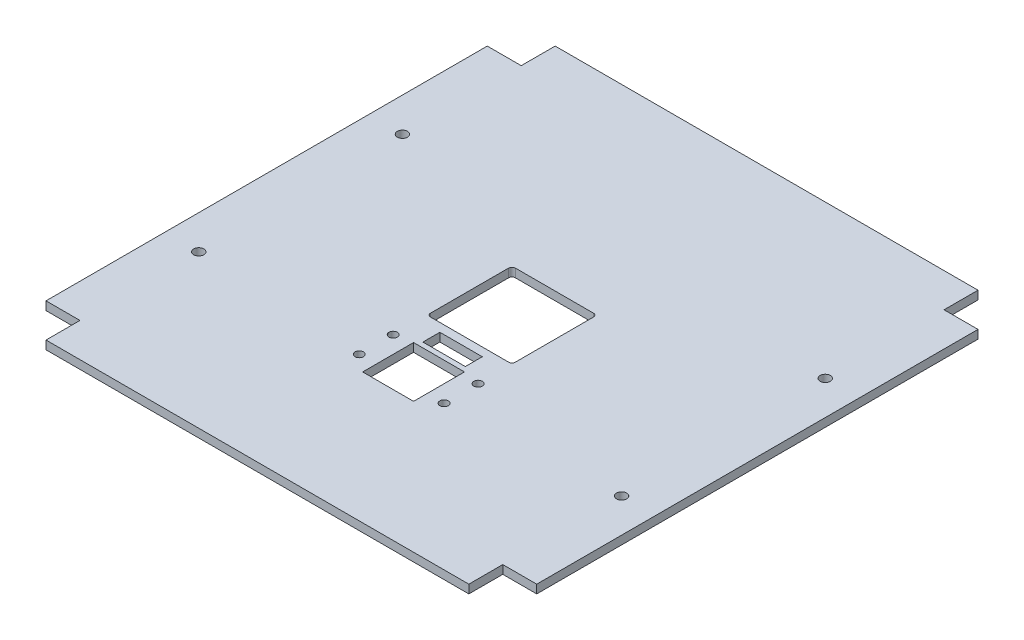
from build123d import *

# Parameters (mm, degrees)
ESQUISSE1_W             = 40
ESQUISSE1_H             = 80
ESQUISSE1_R             = 3
BOSS_EXTRU_1_DEPTH      = 5
ESQUISSE2_R             = 2.5
ESQUISSE2_W             = 30
ESQUISSE2_H             = 30
ESQUISSE2_W_2           = 25
ESQUISSE2_H_2           = 10
ENL_V_MAT_EXTRU_1_DEPTH = 209.386659842
ESQUISSE4_W             = 20
ESQUISSE4_H             = 20
ENL_V_MAT_EXTRU_2_DEPTH = 10


with BuildPart() as part:
    # Esquisse1 → Boss.-Extru.1 (new body)
    # profile 1 of 7: a face of its own
    with BuildSketch(Plane(origin=(0, 0, 0), x_dir=(1, 0, 0), z_dir=(0, 1, 0))):
        with BuildLine():
            ThreePointArc((4.38e-07, -150), (-90.829510449, -119.373363996), (-144.568322948, -40))
            Line((-144.568322948, -40), (-144.568322948, -150))
            Line((-144.568322948, -150), (4.38e-07, -150))
        make_face()
    # profile 2 of 7: a face of its own
    with BuildSketch(Plane(origin=(0, 0, 0), x_dir=(1, 0, 0), z_dir=(0, 1, 0))):
        with BuildLine():
            ThreePointArc((144.568322948, -40), (90.829510797, -119.373363731), (4.38e-07, -150))
            Line((4.38e-07, -150), (144.568322948, -150))
            Line((144.568322948, -150), (144.568322948, -40))
        make_face()
    # profile 3 of 7: a face of its own
    with BuildSketch(Plane(origin=(0, 0, 0), x_dir=(1, 0, 0), z_dir=(0, 1, 0))):
        with Locations((124.568322948, 0)):
            Rectangle(ESQUISSE1_W, ESQUISSE1_H)
    # profile 4 of 7: a face of its own
    with BuildSketch(Plane(origin=(0, 0, 0), x_dir=(1, 0, 0), z_dir=(0, 1, 0))):
        with BuildLine():
            ThreePointArc((2.28e-07, 150), (-90.829510532, 119.373363932), (-144.568322948, 40))
            Line((-144.568322948, 40), (-104.568322948, 40))
            Line((-104.568322948, 40), (-104.568322948, -40))
            Line((-104.568322948, -40), (-144.568322948, -40))
            ThreePointArc((-144.568322948, -40), (-90.829510449, -119.373363996), (4.38e-07, -150))
            ThreePointArc((4.38e-07, -150), (90.829510797, -119.373363731), (144.568322948, -40))
            Line((144.568322948, -40), (104.568322948, -40))
            Line((104.568322948, -40), (104.568322948, 40))
            Line((104.568322948, 40), (144.568322948, 40))
            ThreePointArc((144.568322948, 40), (90.829510714, 119.373363794), (2.28e-07, 150))
        make_face()
        with Locations(Location((-124.568322948, -60, 0), (0, 0, 270))):
            Circle(ESQUISSE1_R, mode=Mode.SUBTRACT)
        with Locations(Location((124.568322948, -60, 0), (0, 0, 270))):
            Circle(ESQUISSE1_R, mode=Mode.SUBTRACT)
        with Locations(Location((-124.568322948, 60, 0), (0, 0, 270))):
            Circle(ESQUISSE1_R, mode=Mode.SUBTRACT)
        with Locations(Location((124.568322948, 60, 0), (0, 0, 270))):
            Circle(ESQUISSE1_R, mode=Mode.SUBTRACT)
    # profile 5 of 7: a face of its own
    with BuildSketch(Plane(origin=(0, 0, 0), x_dir=(1, 0, 0), z_dir=(0, 1, 0))):
        with Locations((-124.568322948, 0)):
            Rectangle(ESQUISSE1_W, ESQUISSE1_H)
    # profile 6 of 7: a face of its own
    with BuildSketch(Plane(origin=(0, 0, 0), x_dir=(1, 0, 0), z_dir=(0, 1, 0))):
        with BuildLine():
            Line((-144.568322948, 150), (-144.568322948, 40))
            ThreePointArc((-144.568322948, 40), (-90.829510532, 119.373363932), (2.28e-07, 150))
            Line((2.28e-07, 150), (-144.568322948, 150))
        make_face()
    # profile 7 of 7: a face of its own
    with BuildSketch(Plane(origin=(0, 0, 0), x_dir=(1, 0, 0), z_dir=(0, 1, 0))):
        with BuildLine():
            Line((144.568322948, 150), (2.28e-07, 150))
            ThreePointArc((2.28e-07, 150), (90.829510714, 119.373363794), (144.568322948, 40))
            Line((144.568322948, 40), (144.568322948, 150))
        make_face()
    extrude(amount=BOSS_EXTRU_1_DEPTH)

    # Esquisse2 → Enlèv. mat.-Extru.1 (cut, through all)
    with BuildSketch(Plane(origin=(0, 5, 0), x_dir=(1, 0, 0), z_dir=(0, 1, 0))):
        with Locations(Location((25, -45, 0), (0, 0, 270))):
            Circle(ESQUISSE2_R)
        with Locations(Location((25, -65, 0), (0, 0, 270))):
            Circle(ESQUISSE2_R)
        with Locations(Location((-25, -45, 0), (0, 0, 270))):
            Circle(ESQUISSE2_R)
        with Locations(Location((-25, -65, 0), (0, 0, 270))):
            Circle(ESQUISSE2_R)
        with BuildLine():
            Line((23, -25), (-23, -25))
            ThreePointArc((-23, -25), (-24.414213562, -24.414213562), (-25, -23))
            Line((-25, -23), (-25, 23))
            ThreePointArc((-25, 23), (-24.414213562, 24.414213562), (-23, 25))
            Line((-23, 25), (23, 25))
            ThreePointArc((23, 25), (24.414213562, 24.414213562), (25, 23))
            Line((25, 23), (25, -23))
            ThreePointArc((25, -23), (24.414213562, -24.414213562), (23, -25))
        make_face()
        with Locations((0, -58)):
            Rectangle(ESQUISSE2_W, ESQUISSE2_H)
        with Locations((0, -35)):
            Rectangle(ESQUISSE2_W_2, ESQUISSE2_H_2)
    extrude(amount=-ENL_V_MAT_EXTRU_1_DEPTH, mode=Mode.SUBTRACT)

    # Esquisse4 → Enlèv. mat.-Extru.2 (cut)
    with BuildSketch(Plane(origin=(0, 5, 0), x_dir=(1, 0, 0), z_dir=(0, 1, 0))):
        with Locations((-134.568322948, 140)):
            Rectangle(ESQUISSE4_W, ESQUISSE4_H)
        with Locations((134.568322948, 140)):
            Rectangle(ESQUISSE4_W, ESQUISSE4_H)
        with Locations((134.568322948, -140)):
            Rectangle(ESQUISSE4_W, ESQUISSE4_H)
        with Locations((-134.568322948, -140)):
            Rectangle(ESQUISSE4_W, ESQUISSE4_H)
    extrude(amount=-ENL_V_MAT_EXTRU_2_DEPTH, mode=Mode.SUBTRACT)


solid = part.part
